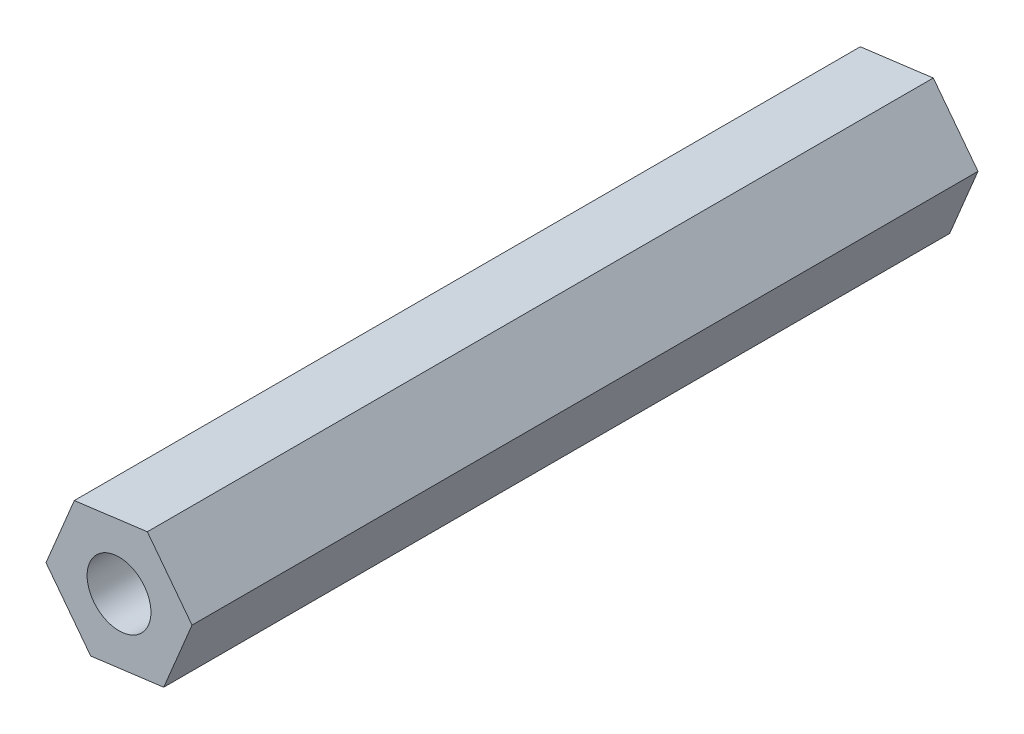
from build123d import *

# Parameters (mm, degrees)
SKETCH1_R           = 3.18
BOSS_EXTRUDE1_DEPTH = 78.27


with BuildPart() as part:
    # Sketch1 → Boss-Extrude1 (new body)
    with BuildSketch(Plane.XY):
        Polygon((7.271508307, 0.942602929), (2.819436071, 6.768612382), (-4.452072235, 5.826009453), (-7.271508307, -0.942602929), (-2.819436071, -6.768612382), (4.452072235, -5.826009453), align=None)
        Circle(SKETCH1_R, mode=Mode.SUBTRACT)
    extrude(amount=BOSS_EXTRUDE1_DEPTH)


solid = part.part
